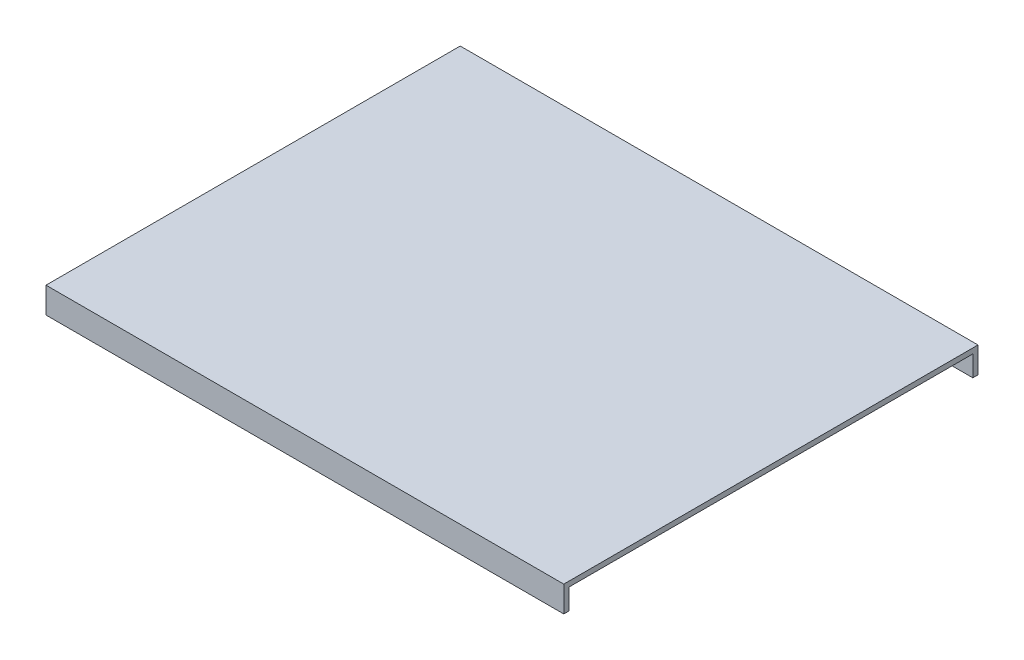
from build123d import *

# Parameters (mm, degrees)
SKIZZE1_W                       = 1000
SKIZZE1_H                       = 50
AUFSATZ_LINEAR_AUSTRAGEN1_DEPTH = 800
SKIZZE2_W                       = 780
SKIZZE2_H                       = 40
SCHNITT_LINEAR_AUSTRAGEN1_DEPTH = 1282.600561798


with BuildPart() as part:
    # Skizze1 → Aufsatz-Linear austragen1 (new body)
    with BuildSketch(Plane.XY):
        with Locations((500, 25)):
            Rectangle(SKIZZE1_W, SKIZZE1_H)
    extrude(amount=AUFSATZ_LINEAR_AUSTRAGEN1_DEPTH)

    # Skizze2 → Schnitt-Linear austragen1 (cut, through all)
    with BuildSketch(Plane(origin=(1000, 0, 0), x_dir=(0, 0, -1), z_dir=(1, 0, 0))):
        with Locations((-400, 20)):
            Rectangle(SKIZZE2_W, SKIZZE2_H)
    extrude(amount=-SCHNITT_LINEAR_AUSTRAGEN1_DEPTH, mode=Mode.SUBTRACT)


solid = part.part
